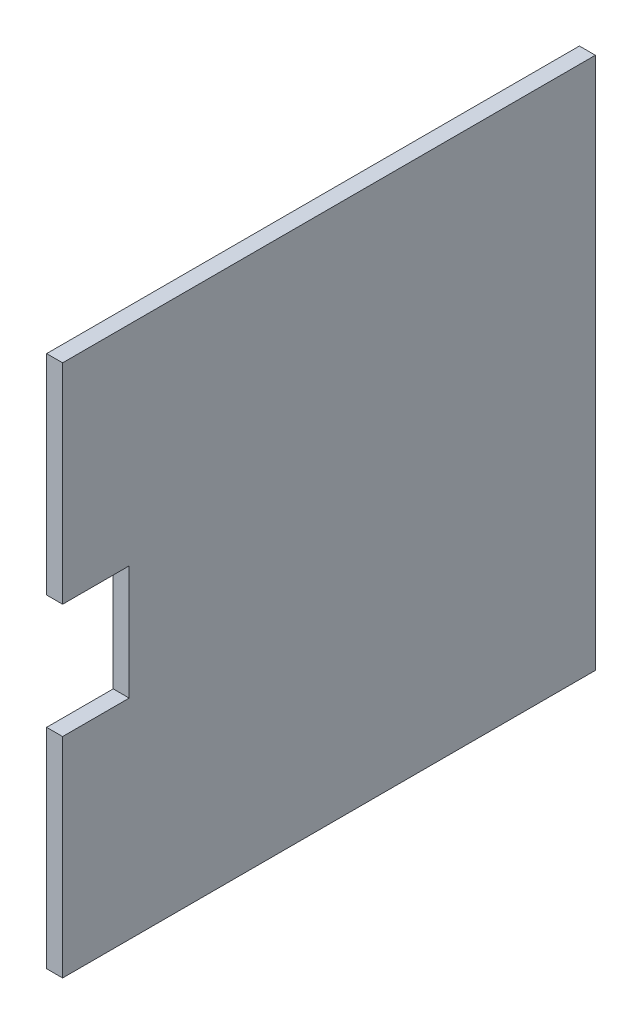
from build123d import *

# Parameters (mm, degrees)
BOSS_EXTRUDE1_DEPTH = 6


with BuildPart() as part:
    # Sketch1 → Boss-Extrude1 (new body)
    with BuildSketch(Plane(origin=(0, 0, 0), x_dir=(0, 0, -1), z_dir=(1, 0, 0))):
        Polygon((-81.03030303, -37.59069275), (-81.03030303, -116.09069275), (118.96969697, -116.09069275), (118.96969697, 83.90930725), (-81.03030303, 83.90930725), (-81.03030303, 5.40930725), (-56.03030303, 5.40930725), (-56.03030303, -16.09069275), (-56.03030303, -37.59069275), align=None)
    extrude(amount=BOSS_EXTRUDE1_DEPTH)


solid = part.part
